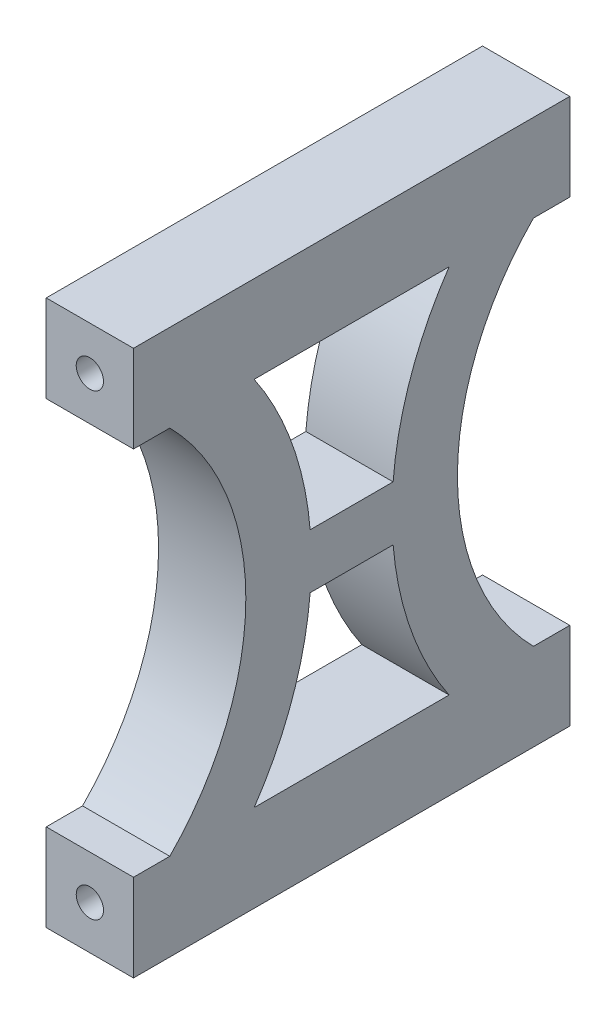
from build123d import *

# Parameters (mm, degrees)
SKETCH1_W             = 8
SKETCH1_H             = 8
SKETCH1_R             = 1.25
BOSS_EXTRUDE1_DEPTH   = 40
BOSS_EXTRUDE1_2_DEPTH = 40
BOSS_EXTRUDE2_DEPTH   = 8


with BuildPart() as part:
    # Sketch1 → Boss-Extrude1 (new body)
    with BuildSketch(Plane.XY):
        with Locations((0, 21)):
            Rectangle(SKETCH1_W, SKETCH1_H)
        with Locations((0, 21)):
            Circle(SKETCH1_R, mode=Mode.SUBTRACT)
    extrude(amount=BOSS_EXTRUDE1_DEPTH)



with BuildPart() as body_2:
    # Sketch1 → Boss-Extrude1 2 (new body)
    with BuildSketch(Plane.XY):
        with Locations((0, -21)):
            Rectangle(SKETCH1_W, SKETCH1_H)
        with Locations(Location((0, -21, 0), (0, 0, 180))):
            Circle(SKETCH1_R, mode=Mode.SUBTRACT)
    extrude(amount=BOSS_EXTRUDE1_2_DEPTH)


with BuildPart() as part_1:
    add(part.part)

    add(body_2.part)  # Boss-Extrude2 merges body 2
    # Sketch2 → Boss-Extrude2 (add)
    with BuildSketch(Plane.ZY.offset(4)):
        with BuildLine():
            Line((3.329640508, 17), (11.063985021, 17))
            ThreePointArc((11.063985021, 17), (14.56966913, 10.077818269), (16.196928044, 2.491089763))
            Line((16.196928044, 2.491089763), (23.803071956, 2.491089763))
            ThreePointArc((23.803071956, 2.491089763), (25.43033087, 10.077818269), (28.936014979, 17))
            Line((28.936014979, 17), (36.670359492, 17))
            ThreePointArc((36.670359492, 17), (29.700211914, 0), (36.670359492, -17))
            Line((36.670359492, -17), (28.936014979, -17))
            ThreePointArc((28.936014979, -17), (25.433314102, -10.086246784), (23.804551435, -2.508910237))
            Line((23.804551435, -2.508910237), (16.195448565, -2.508910237))
            ThreePointArc((16.195448565, -2.508910237), (14.566685898, -10.086246784), (11.063985021, -17))
            Line((11.063985021, -17), (3.329640508, -17))
            ThreePointArc((3.329640508, -17), (10.299788086, 0), (3.329640508, 17))
        make_face()
    extrude(amount=-BOSS_EXTRUDE2_DEPTH)


solid = part_1.part
